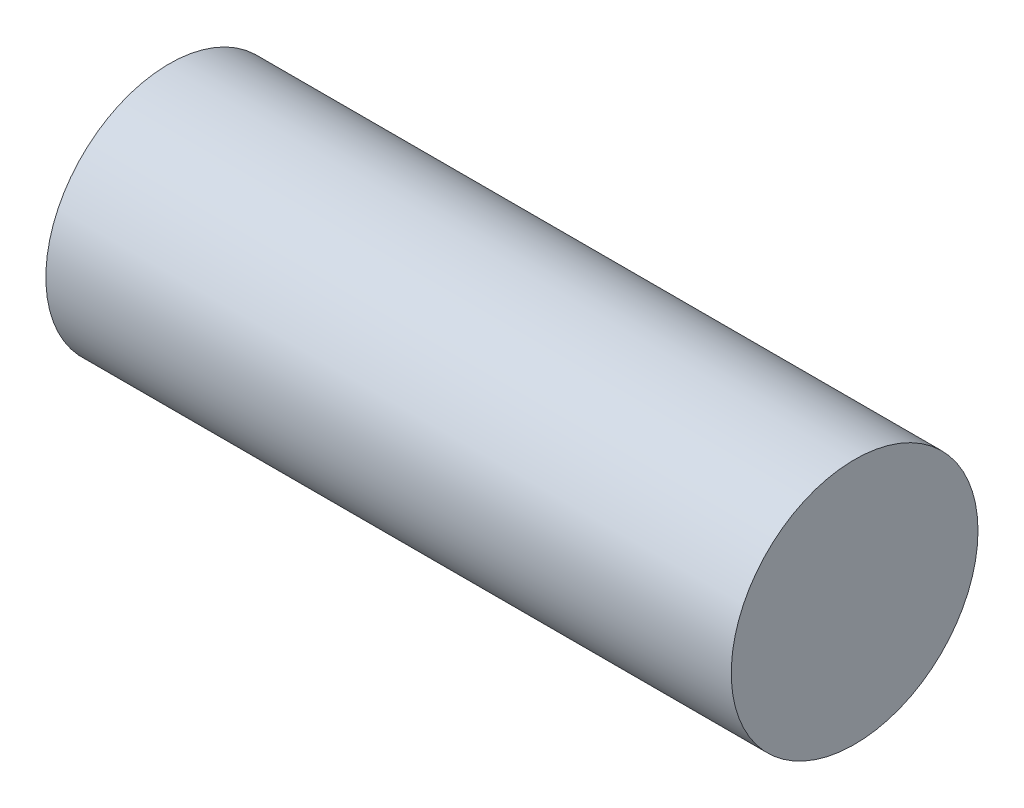
from build123d import *

# Parameters (mm, degrees)
SKETCH1_R           = 2.25
BOSS_EXTRUDE1_DEPTH = 12.5


with BuildPart() as part:
    # Sketch1 → Boss-Extrude1 (new body)
    with BuildSketch(Plane(origin=(0, 0, 0), x_dir=(0, 0, -1), z_dir=(1, 0, 0))):
        Circle(SKETCH1_R)
    extrude(amount=BOSS_EXTRUDE1_DEPTH)


solid = part.part
